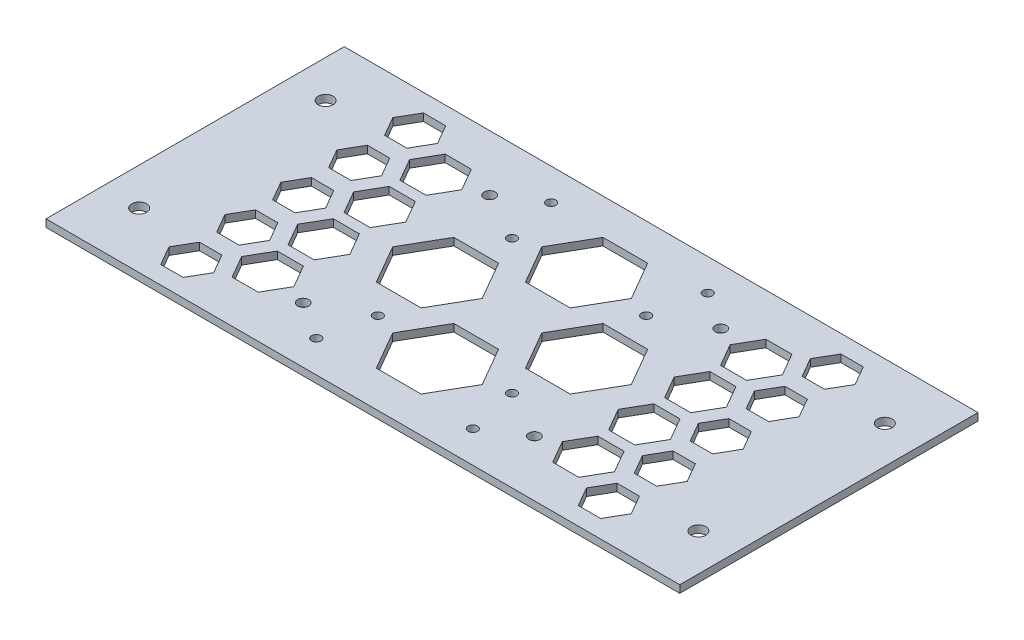
from build123d import *

# Parameters (mm, degrees)
SKETCH_1_W          = 170
SKETCH_1_H          = 80
SKETCH_1_R          = 2
SKETCH_1_R_2        = 1.25
SKETCH_1_R_3        = 1.5
EXTRUDE_1_DEPTH     = 2
CUT_EXTRUDE_1_DEPTH = 50
CUT_EXTRUDE_2_DEPTH = 50
CUT_EXTRUDE_3_DEPTH = 50


with BuildPart() as part:
    # 草图1 → 凸台-拉伸1 (new body)
    with BuildSketch(Plane(origin=(0, 0, 0), x_dir=(1, 0, 0), z_dir=(0, 1, 0))):
        with Locations((85, 40)):
            Rectangle(SKETCH_1_W, SKETCH_1_H)
        with Locations(Location((10, 65, 0), (0, 0, 270))):
            Circle(SKETCH_1_R, mode=Mode.SUBTRACT)
        with Locations(Location((10, 15, 0), (0, 0, 90))):
            Circle(SKETCH_1_R, mode=Mode.SUBTRACT)
        with Locations(Location((160, 15, 0), (0, 0, 270))):
            Circle(SKETCH_1_R, mode=Mode.SUBTRACT)
        with Locations(Location((160, 65, 0), (0, 0, 90))):
            Circle(SKETCH_1_R, mode=Mode.SUBTRACT)
        with Locations(Location((67, 58, 0), (0, 0, 270))):
            Circle(SKETCH_1_R_2, mode=Mode.SUBTRACT)
        with Locations(Location((67, 22, 0), (0, 0, 90))):
            Circle(SKETCH_1_R_2, mode=Mode.SUBTRACT)
        with Locations(Location((103, 22, 0), (0, 0, 270))):
            Circle(SKETCH_1_R_2, mode=Mode.SUBTRACT)
        with Locations(Location((103, 58, 0), (0, 0, 90))):
            Circle(SKETCH_1_R_2, mode=Mode.SUBTRACT)
        with Locations(Location((64, 71.5, 0), (0, 0, 270))):
            Circle(SKETCH_1_R_2, mode=Mode.SUBTRACT)
        with Locations(Location((64, 8.5, 0), (0, 0, 90))):
            Circle(SKETCH_1_R_2, mode=Mode.SUBTRACT)
        with Locations(Location((106, 8.5, 0), (0, 0, 270))):
            Circle(SKETCH_1_R_2, mode=Mode.SUBTRACT)
        with Locations(Location((106, 71.5, 0), (0, 0, 90))):
            Circle(SKETCH_1_R_2, mode=Mode.SUBTRACT)
        with Locations(Location((54, 65, 0), (0, 0, 270))):
            Circle(SKETCH_1_R_3, mode=Mode.SUBTRACT)
        with Locations(Location((54, 15, 0), (0, 0, 90))):
            Circle(SKETCH_1_R_3, mode=Mode.SUBTRACT)
        with Locations(Location((116, 15, 0), (0, 0, 270))):
            Circle(SKETCH_1_R_3, mode=Mode.SUBTRACT)
        with Locations(Location((116, 65, 0), (0, 0, 90))):
            Circle(SKETCH_1_R_3, mode=Mode.SUBTRACT)
    extrude(amount=EXTRUDE_1_DEPTH)

    # 草图3 → 切除-拉伸1 (cut)
    with BuildSketch(Plane(origin=(0, 2, 0), x_dir=(1, 0, 0), z_dir=(0, 1, 0))):
        Polygon((26, 15.173938425), (23, 9.977786002), (26, 4.781633579), (32, 4.781633579), (35, 9.977786002), (32, 15.173938425), align=None)
        Polygon((38.5, 23.545517328), (35, 17.483339502), (38.5, 11.421161675), (45.5, 11.421161675), (49, 17.483339502), (45.5, 23.545517328), align=None)
        Polygon((32, 30.185045424), (26, 30.185045424), (23, 24.988893001), (26, 19.792740578), (32, 19.792740578), (35, 24.988893001), align=None)
        Polygon((45.5, 38.556624327), (38.5, 38.556624327), (35, 32.494446501), (38.5, 26.432268674), (45.5, 26.432268674), (49, 32.494446501), align=None)
        Polygon((32, 45.196152423), (26, 45.196152423), (23, 40), (26, 34.803847577), (32, 34.803847577), (35, 40), align=None)
        Polygon((49, 47.505553499), (45.5, 41.443375673), (38.5, 41.443375673), (35, 47.505553499), (38.5, 53.567731326), (45.5, 53.567731326), align=None)
        Polygon((45.5, 56.454482672), (38.5, 56.454482672), (35, 62.516660498), (38.5, 68.578838325), (45.5, 68.578838325), (49, 62.516660498), align=None)
        Polygon((35, 55.011106999), (32, 49.814954576), (26, 49.814954576), (23, 55.011106999), (26, 60.207259422), (32, 60.207259422), align=None)
        Polygon((32, 64.826061575), (26, 64.826061575), (23, 70.022213998), (26, 75.218366421), (32, 75.218366421), (35, 70.022213998), align=None)
        Polygon((144, 64.826061575), (147, 70.022213998), (144, 75.218366421), (138, 75.218366421), (135, 70.022213998), (138, 64.826061575), align=None)
        Polygon((138, 49.814954576), (144, 49.814954576), (147, 55.011106999), (144, 60.207259422), (138, 60.207259422), (135, 55.011106999), align=None)
        Polygon((131.5, 56.454482672), (135, 62.516660498), (131.5, 68.578838325), (124.5, 68.578838325), (121, 62.516660498), (124.5, 56.454482672), align=None)
        Polygon((124.5, 41.443375673), (131.5, 41.443375673), (135, 47.505553499), (131.5, 53.567731326), (124.5, 53.567731326), (121, 47.505553499), align=None)
        Polygon((135, 40), (138, 45.196152423), (144, 45.196152423), (147, 40), (144, 34.803847577), (138, 34.803847577), align=None)
        Polygon((121, 32.494446501), (124.5, 38.556624327), (131.5, 38.556624327), (135, 32.494446501), (131.5, 26.432268674), (124.5, 26.432268674), align=None)
        Polygon((135, 24.988893001), (138, 30.185045424), (144, 30.185045424), (147, 24.988893001), (144, 19.792740578), (138, 19.792740578), align=None)
        Polygon((124.5, 23.545517328), (131.5, 23.545517328), (135, 17.483339502), (131.5, 11.421161675), (124.5, 11.421161675), (121, 17.483339502), align=None)
        Polygon((138, 15.173938425), (144, 15.173938425), (147, 9.977786002), (144, 4.781633579), (138, 4.781633579), (135, 9.977786002), align=None)
    extrude(amount=-CUT_EXTRUDE_1_DEPTH, mode=Mode.SUBTRACT)

    # 草图4 → 切除-拉伸2 (cut)
    with BuildSketch(Plane(origin=(0, 2, 0), x_dir=(1, 0, 0), z_dir=(0, 1, 0))):
        Polygon((77, 40), (71, 50.392304845), (59, 50.392304845), (53, 40), (59, 29.607695155), (71, 29.607695155), align=None)
        Polygon((99, 29.607695155), (93, 40), (99, 50.392304845), (111, 50.392304845), (117, 40), (111, 29.607695155), align=None)
    extrude(amount=-CUT_EXTRUDE_2_DEPTH, mode=Mode.SUBTRACT)

    # 草图5 → 切除-拉伸3 (cut)
    with BuildSketch(Plane(origin=(0, 2, 0), x_dir=(1, 0, 0), z_dir=(0, 1, 0))):
        Polygon((91, 30.392304845), (79, 30.392304845), (73, 20), (79, 9.607695155), (91, 9.607695155), (97, 20), align=None)
        Polygon((97, 60), (91, 49.607695155), (79, 49.607695155), (73, 60), (79, 70.392304845), (91, 70.392304845), align=None)
    extrude(amount=-CUT_EXTRUDE_3_DEPTH, mode=Mode.SUBTRACT)


solid = part.part
